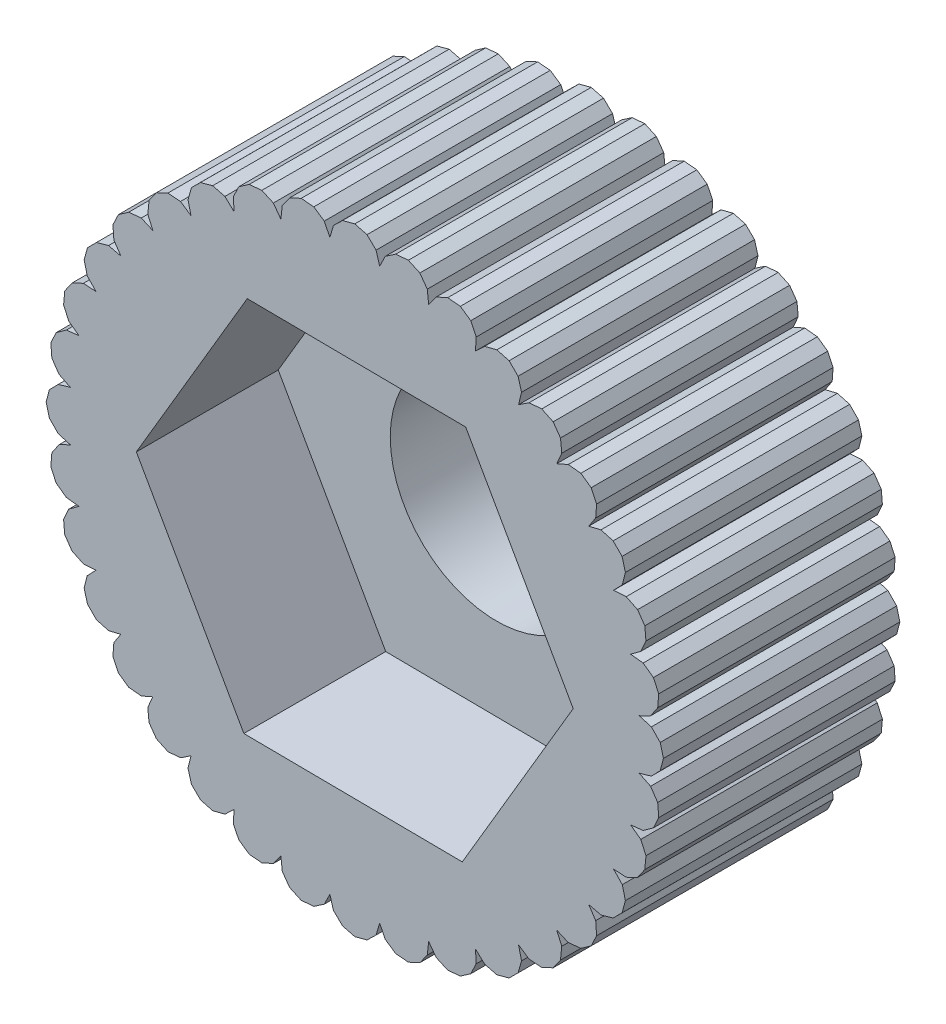
from build123d import *

# Parameters (mm, degrees)
BOSS_EXTRU_1_DEPTH      = 5
ENL_V_MAT_EXTRU_1_DEPTH = 3
ESQUISSE3_R             = 2.25
ENL_V_MAT_EXTRU_2_DEPTH = 19.701677519


with BuildPart() as part:
    # Esquisse1 → Boss.-Extru.1 (new body)
    with BuildSketch(Plane.XY.offset(5)):
        Polygon((4.963769, 12.35828), (4.805141, 12.57402), (4.560901, 12.68381), (4.294249, 12.65924), (4.074186, 12.50666), (3.957658, 12.26556), (3.974817, 11.99833), (3.781135, 12.18325), (3.521541, 12.24896), (3.263207, 12.17845), (3.072982, 11.98998), (3.00009, 11.73231), (3.063393, 11.47212), (2.840543, 11.6206), (2.573482, 11.64023), (2.331316, 11.52594), (2.176709, 11.3073), (2.149668, 11.04088), (2.257191, 10.79564), (2.011945, 10.90316), (1.745531, 10.87612), (1.526891, 10.72151), (1.412599, 10.47935), (1.432232, 10.21228), (1.580707, 9.989435), (1.320515, 10.05274), (1.062845, 9.979846), (0.8743736, 9.78962), (0.8038701, 9.531287), (0.8695787, 9.271692), (1.054497, 9.078011), (0.7872651, 9.09517), (0.5461671, 8.978642), (0.3935909, 8.758578), (0.3690175, 8.491927), (0.4788064, 8.247686), (0.6945468, 8.089058), (0.4283958, 8.059552), (0.2111956, 7.902928), (0.09915093, 7.659714), (0.1212545, 7.392846), (0.2717869, 7.171381), (0.5117958, 7.052625), (0.2548117, 6.97735), (0.06810902, 6.785389), (0, 6.526414), (0.06810902, 6.267438), (0.2548117, 6.075477), (0.5117958, 6.000203), (0.2717869, 5.881447), (0.1212545, 5.659982), (0.09915093, 5.393114), (0.2111956, 5.1499), (0.4283958, 4.993276), (0.6945468, 4.963769), (0.4788064, 4.805141), (0.3690175, 4.560901), (0.3935909, 4.294249), (0.5461671, 4.074186), (0.7872651, 3.957658), (1.054497, 3.974817), (0.8695787, 3.781135), (0.8038701, 3.521541), (0.8743736, 3.263207), (1.062845, 3.072982), (1.320515, 3.00009), (1.580707, 3.063393), (1.432232, 2.840543), (1.412599, 2.573482), (1.526891, 2.331316), (1.745531, 2.176709), (2.011945, 2.149668), (2.257191, 2.257191), (2.149668, 2.011945), (2.176709, 1.745531), (2.331316, 1.526891), (2.573482, 1.412599), (2.840543, 1.432232), (3.063393, 1.580707), (3.00009, 1.320515), (3.072982, 1.062845), (3.263207, 0.8743736), (3.521541, 0.8038701), (3.781135, 0.8695787), (3.974817, 1.054497), (3.957658, 0.7872651), (4.074186, 0.5461671), (4.294249, 0.3935909), (4.560901, 0.3690175), (4.805141, 0.4788064), (4.963769, 0.6945468), (4.993276, 0.4283958), (5.1499, 0.2111956), (5.393114, 0.09915093), (5.659982, 0.1212545), (5.881447, 0.2717869), (6.000203, 0.5117958), (6.075477, 0.2548117), (6.267438, 0.06810902), (6.526414, 0), (6.785389, 0.06810902), (6.97735, 0.2548117), (7.052625, 0.5117958), (7.171381, 0.2717869), (7.392846, 0.1212545), (7.659714, 0.09915093), (7.902928, 0.2111956), (8.059552, 0.4283958), (8.089058, 0.6945468), (8.247686, 0.4788064), (8.491927, 0.3690175), (8.758578, 0.3935909), (8.978642, 0.5461671), (9.09517, 0.7872651), (9.078011, 1.054497), (9.271692, 0.8695787), (9.531287, 0.8038701), (9.78962, 0.8743736), (9.979846, 1.062845), (10.05274, 1.320515), (9.989435, 1.580707), (10.21228, 1.432232), (10.47935, 1.412599), (10.72151, 1.526891), (10.87612, 1.745531), (10.90316, 2.011945), (10.79564, 2.257191), (11.04088, 2.149668), (11.3073, 2.176709), (11.52594, 2.331316), (11.64023, 2.573482), (11.6206, 2.840543), (11.47212, 3.063393), (11.73231, 3.00009), (11.98998, 3.072982), (12.17845, 3.263207), (12.24896, 3.521541), (12.18325, 3.781135), (11.99833, 3.974817), (12.26556, 3.957658), (12.50666, 4.074186), (12.65924, 4.294249), (12.68381, 4.560901), (12.57402, 4.805141), (12.35828, 4.963769), (12.62443, 4.993276), (12.84163, 5.1499), (12.95368, 5.393114), (12.93157, 5.659982), (12.78104, 5.881447), (12.54103, 6.000203), (12.79802, 6.075477), (12.98472, 6.267438), (13.05283, 6.526414), (12.98472, 6.785389), (12.79802, 6.97735), (12.54103, 7.052625), (12.78104, 7.171381), (12.93157, 7.392846), (12.95368, 7.659714), (12.84163, 7.902928), (12.62443, 8.059552), (12.35828, 8.089058), (12.57402, 8.247686), (12.68381, 8.491927), (12.65924, 8.758578), (12.50666, 8.978642), (12.26556, 9.09517), (11.99833, 9.078011), (12.18325, 9.271692), (12.24896, 9.531287), (12.17845, 9.78962), (11.98998, 9.979846), (11.73231, 10.05274), (11.47212, 9.989435), (11.6206, 10.21228), (11.64023, 10.47935), (11.52594, 10.72151), (11.3073, 10.87612), (11.04088, 10.90316), (10.79564, 10.79564), (10.90316, 11.04088), (10.87612, 11.3073), (10.72151, 11.52594), (10.47935, 11.64023), (10.21228, 11.6206), (9.989435, 11.47212), (10.05274, 11.73231), (9.979846, 11.98998), (9.78962, 12.17845), (9.531287, 12.24896), (9.271692, 12.18325), (9.078011, 11.99833), (9.09517, 12.26556), (8.978642, 12.50666), (8.758578, 12.65924), (8.491927, 12.68381), (8.247686, 12.57402), (8.089058, 12.35828), (8.059552, 12.62443), (7.902928, 12.84163), (7.659714, 12.95368), (7.392846, 12.93157), (7.171381, 12.78104), (7.052625, 12.54103), (6.97735, 12.79802), (6.785389, 12.98472), (6.526414, 13.05283), (6.267438, 12.98472), (6.075477, 12.79802), (6.000203, 12.54103), (5.881447, 12.78104), (5.659982, 12.93157), (5.393114, 12.95368), (5.1499, 12.84163), (4.993276, 12.62443), align=None)
    extrude(amount=-BOSS_EXTRU_1_DEPTH)

    # Esquisse2 → Enlèv. mat.-Extru.1 (cut)
    with BuildSketch(Plane.XY.offset(5)):
        Polygon((11.14503, 6.48457), (8.871958, 10.50533), (4.253345, 10.54717), (1.907801, 6.568258), (4.18087, 2.5475), (8.799482, 2.505656), align=None)
    extrude(amount=-ENL_V_MAT_EXTRU_1_DEPTH, mode=Mode.SUBTRACT)

    # Esquisse3 → Enlèv. mat.-Extru.2 (cut, through all)
    with BuildSketch(Plane.XY.offset(2)):
        with Locations((6.526414618, 6.526413042)):
            Circle(ESQUISSE3_R)
    extrude(amount=-ENL_V_MAT_EXTRU_2_DEPTH, mode=Mode.SUBTRACT)


solid = part.part
